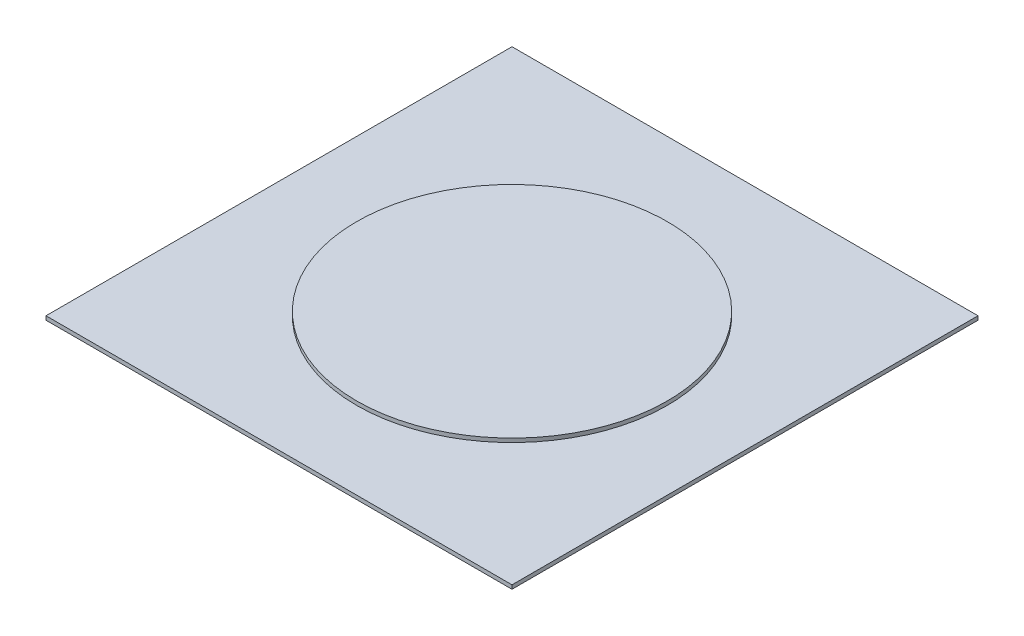
from build123d import *

# Parameters (mm, degrees)
SKETCH_1_W      = 120
SKETCH_1_H      = 120
EXTRUDE_1_DEPTH = 1
SKETCH_2_R      = 40
EXTRUDE_2_DEPTH = 1


with BuildPart() as part:
    # 草图1 → 凸台-拉伸1 (new body)
    with BuildSketch(Plane(origin=(0, 0, 0), x_dir=(1, 0, 0), z_dir=(0, 1, 0))):
        Rectangle(SKETCH_1_W, SKETCH_1_H)
    extrude(amount=EXTRUDE_1_DEPTH)

    # 草图2 → 凸台-拉伸2 (add)
    with BuildSketch(Plane(origin=(0, 1, 0), x_dir=(1, 0, 0), z_dir=(0, 1, 0))):
        with Locations(Location((0, 0, 0), (0, 0, 270))):
            Circle(SKETCH_2_R)
    extrude(amount=EXTRUDE_2_DEPTH)


solid = part.part
